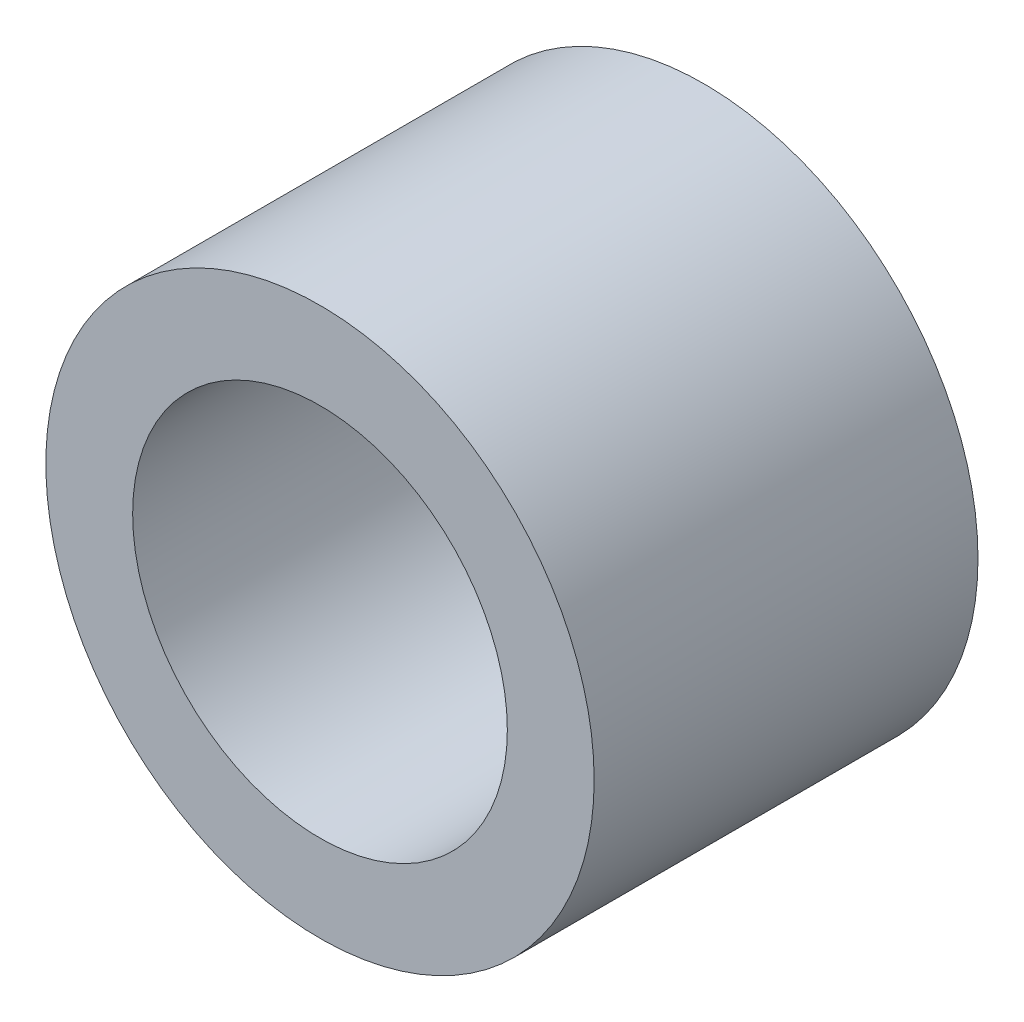
from build123d import *

# Parameters (mm, degrees)
S01_SMOOTH_CYLINDRICAL_SECTION_R      = 3
S01_SMOOTH_CYLINDRICAL_SECTION_R_2    = 2.05
F_01_SMOOTH_CYLINDRICAL_SECTION_DEPTH = 4.2


with BuildPart() as part:
    # S01 - Smooth cylindrical section → 01 - Smooth cylindrical section (new body)
    with BuildSketch(Plane.XY):
        Circle(S01_SMOOTH_CYLINDRICAL_SECTION_R)
        Circle(S01_SMOOTH_CYLINDRICAL_SECTION_R_2, mode=Mode.SUBTRACT)
    extrude(amount=F_01_SMOOTH_CYLINDRICAL_SECTION_DEPTH)


solid = part.part
